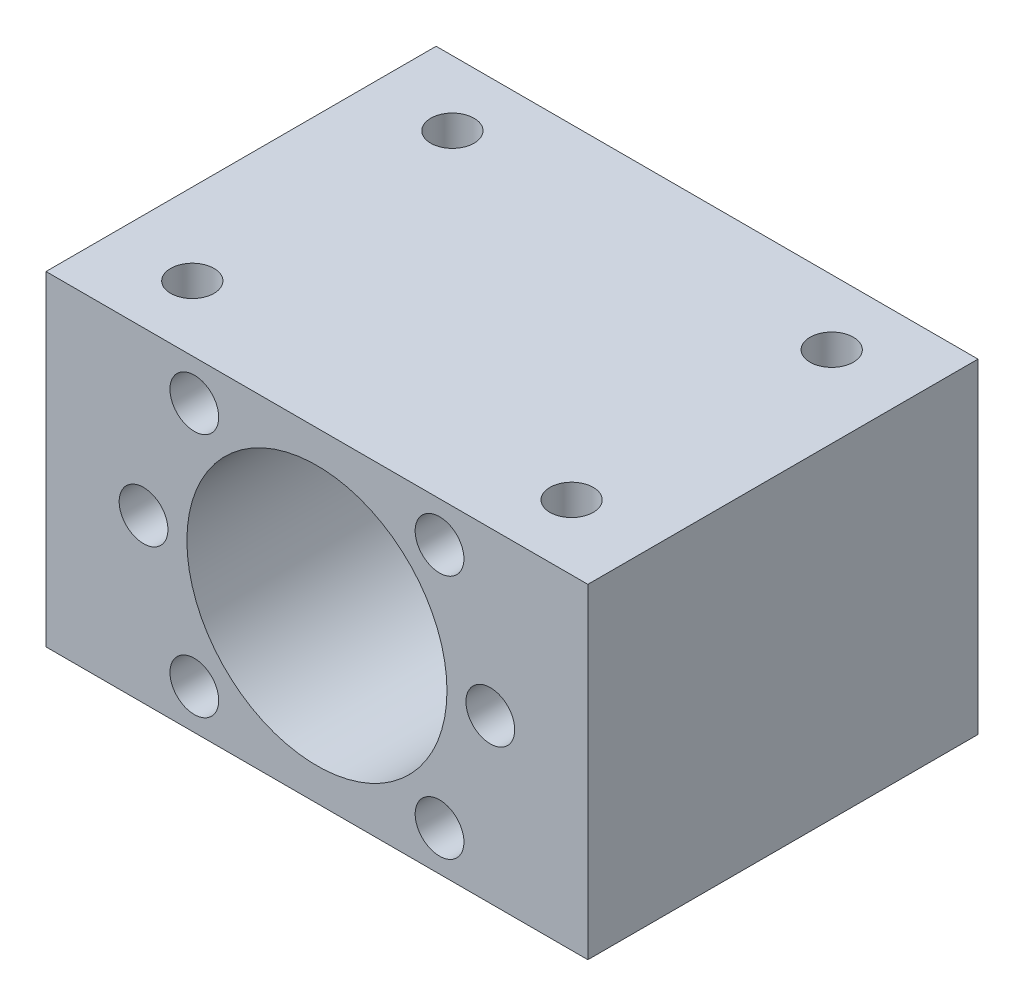
from build123d import *

# Parameters (mm, degrees)
SKETCH_1_W          = 50
SKETCH_1_H          = 30
SKETCH_1_R          = 2.25
SKETCH_1_R_2        = 12
EXTRUDE_1_DEPTH     = 36
SKETCH_2_R          = 2
CUT_EXTRUDE_1_DEPTH = 10.2


with BuildPart() as part:
    # 草图1 → 凸台-拉伸1 (new body)
    with BuildSketch(Plane.XY):
        Rectangle(SKETCH_1_W, SKETCH_1_H)
        with Locations((-11.313708499, 11.313708499)):
            Circle(SKETCH_1_R, mode=Mode.SUBTRACT)
        with Locations((-16, 0)):
            Circle(SKETCH_1_R, mode=Mode.SUBTRACT)
        with Locations((-11.313708499, -11.313708499)):
            Circle(SKETCH_1_R, mode=Mode.SUBTRACT)
        with Locations((11.313708499, -11.313708499)):
            Circle(SKETCH_1_R, mode=Mode.SUBTRACT)
        with Locations((16, 0)):
            Circle(SKETCH_1_R, mode=Mode.SUBTRACT)
        with Locations((11.313708499, 11.313708499)):
            Circle(SKETCH_1_R, mode=Mode.SUBTRACT)
        Circle(SKETCH_1_R_2, mode=Mode.SUBTRACT)
    extrude(amount=EXTRUDE_1_DEPTH)

    # 草图2 → 切除-拉伸1 (cut)
    with BuildSketch(Plane(origin=(0, 15, 0), x_dir=(1, 0, 0), z_dir=(0, 1, 0))):
        with Locations(Location((17.5, -30, 0), (0, 0, 270))):
            Circle(SKETCH_2_R)
        with Locations(Location((-17.5, -30, 0), (0, 0, 90))):
            Circle(SKETCH_2_R)
        with Locations(Location((-17.5, -6, 0), (0, 0, 270))):
            Circle(SKETCH_2_R)
        with Locations(Location((17.5, -6, 0), (0, 0, 90))):
            Circle(SKETCH_2_R)
    extrude(amount=-CUT_EXTRUDE_1_DEPTH, mode=Mode.SUBTRACT)


solid = part.part
